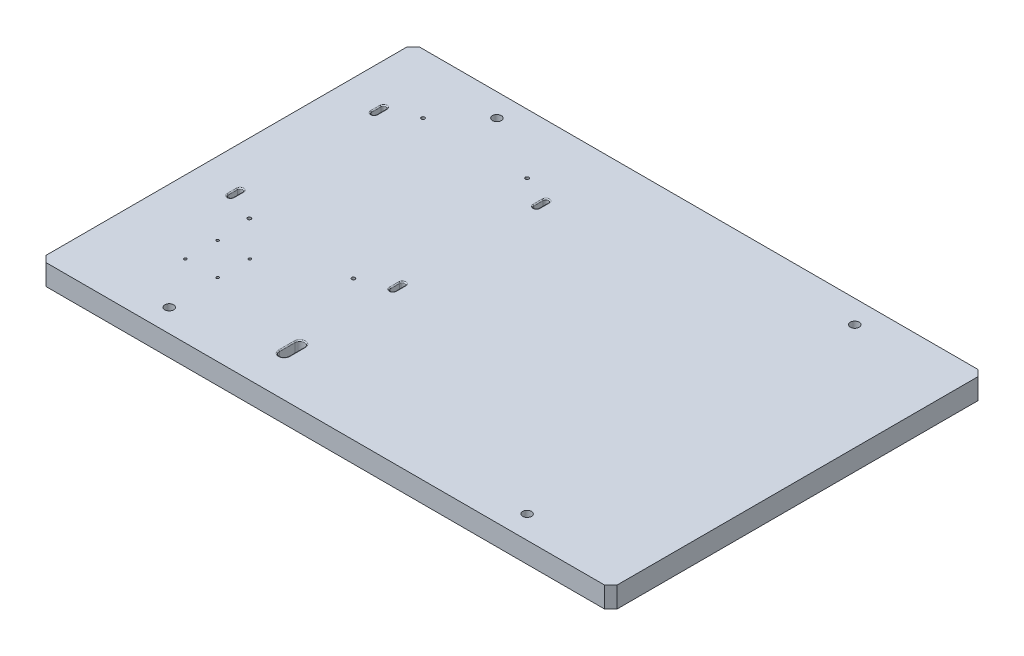
from build123d import *

# Parameters (mm, degrees)
SKETCH_1_W               = 549
SKETCH_1_H               = 359
EXTRUDE_1_DEPTH          = 20
HOLE_WIZARD_M10_1_D      = 8.5
HOLE_WIZARD_M4_1_D       = 3.3
CUT_EXTRUDE_1_DEPTH      = 588.021377852
CUT_EXTRUDE_1_DEPTH_BACK = 588.021377852
CHAMFER_1_SIZE           = 6
FILLET_2_R               = 1
CUT_EXTRUDE_4_DEPTH      = 20
HOLE_WIZARD_M3_2_D       = 2.5
FILLET_4_R               = 1
SKETCH_20_R              = 8.1
CUT_EXTRUDE_5_DEPTH      = 10


with BuildPart() as part:
    # 草图1 → 凸台-拉伸1 (new body)
    with BuildSketch(Plane(origin=(0, 0, 0), x_dir=(1, 0, 0), z_dir=(0, 1, 0))):
        with Locations((214.498740765, -144.65170767)):
            Rectangle(SKETCH_1_W, SKETCH_1_H)
    extrude(amount=EXTRUDE_1_DEPTH)

    # M10 螺纹孔1 (through all)
    with Locations(Plane(origin=(0, 20, 0), x_dir=(1, 0, 0), z_dir=(0, 1, 0))):
        with Locations((386.498740765, -302.15170767), (42.498740765, 12.84829233), (386.498740765, 12.84829233), (42.498740765, -302.15170767)):
            Hole(HOLE_WIZARD_M10_1_D / 2)

    # M4 螺纹孔1 (through all)
    with Locations(Plane(origin=(0, 20, 0), x_dir=(1, 0, 0), z_dir=(0, 1, 0))):
        with Locations((6.998740765, -189.65170767), (6.998740765, -22.65170767), (106.998740765, -22.65170767), (106.998740765, -189.65170767)):
            Hole(HOLE_WIZARD_M4_1_D / 2)

    # 草图9 → 切除-拉伸1 (cut, two sides: drawn at the far end of the back side and taken through both)
    with BuildSketch(Plane(origin=(0, 20, 0), x_dir=(1, 0, 0), z_dir=(0, 1, 0)).offset(-CUT_EXTRUDE_1_DEPTH_BACK)):
        with BuildLine():
            Line((-18.501259235, -32.65170767), (-18.501259235, -41.65170767))
            ThreePointArc((-18.501259235, -41.65170767), (-21.001259235, -44.15170767), (-23.501259235, -41.65170767))
            Line((-23.501259235, -41.65170767), (-23.501259235, -32.65170767))
            ThreePointArc((-23.501259235, -32.65170767), (-21.001259235, -30.15170767), (-18.501259235, -32.65170767))
        make_face()
        with BuildLine():
            Line((132.498740765, -32.65170767), (132.498740765, -41.65170767))
            ThreePointArc((132.498740765, -41.65170767), (134.998740765, -44.15170767), (137.498740765, -41.65170767))
            Line((137.498740765, -41.65170767), (137.498740765, -32.65170767))
            ThreePointArc((137.498740765, -32.65170767), (134.998740765, -30.15170767), (132.498740765, -32.65170767))
        make_face()
        with BuildLine():
            Line((132.498740765, -179.65170767), (132.498740765, -170.65170767))
            ThreePointArc((132.498740765, -170.65170767), (134.998740765, -168.15170767), (137.498740765, -170.65170767))
            Line((137.498740765, -170.65170767), (137.498740765, -179.65170767))
            ThreePointArc((137.498740765, -179.65170767), (134.998740765, -182.15170767), (132.498740765, -179.65170767))
        make_face()
        with BuildLine():
            Line((-18.501259235, -179.65170767), (-18.501259235, -170.65170767))
            ThreePointArc((-18.501259235, -170.65170767), (-21.001259235, -168.15170767), (-23.501259235, -170.65170767))
            Line((-23.501259235, -170.65170767), (-23.501259235, -179.65170767))
            ThreePointArc((-23.501259235, -179.65170767), (-21.001259235, -182.15170767), (-18.501259235, -179.65170767))
        make_face()
    extrude(amount=CUT_EXTRUDE_1_DEPTH + CUT_EXTRUDE_1_DEPTH_BACK, mode=Mode.SUBTRACT)

    # 倒角1
    chamfer_1_edges = [part.edges().sort_by_distance(p)[0] for p in [
        (-60.001259235, 10, -34.84829233),
        (488.998740765, 10, -34.84829233),
        (488.998740765, 10, 324.15170767),
        (-60.001259235, 10, 324.15170767),
    ]]
    chamfer(chamfer_1_edges, length=CHAMFER_1_SIZE)

    # 圆角2
    fillet_2_edges = [part.edges().sort_by_distance(p)[0] for p in [
        (134.998740765, 20, 44.15170767),
        (137.498740765, 20, 37.15170767),
        (-21.001259235, 0, 30.15170767),
        (-18.501259235, 0, 37.15170767),
        (-21.001259235, 0, 44.15170767),
        (-23.501259235, 0, 37.15170767),
        (-21.001259235, 20, 30.15170767),
        (-23.501259235, 20, 37.15170767),
        (-21.001259235, 20, 44.15170767),
        (-18.501259235, 20, 37.15170767),
        (-21.001259235, 0, 182.15170767),
        (-23.501259235, 0, 175.15170767),
        (-21.001259235, 0, 168.15170767),
        (-18.501259235, 0, 175.15170767),
        (-21.001259235, 20, 182.15170767),
        (-18.501259235, 20, 175.15170767),
        (-21.001259235, 20, 168.15170767),
        (-23.501259235, 20, 175.15170767),
        (134.998740765, 0, 182.15170767),
        (132.498740765, 0, 175.15170767),
        (134.998740765, 0, 168.15170767),
        (137.498740765, 0, 175.15170767),
        (134.998740765, 20, 182.15170767),
        (137.498740765, 20, 175.15170767),
        (134.998740765, 20, 168.15170767),
        (132.498740765, 20, 175.15170767),
        (134.998740765, 0, 30.15170767),
        (137.498740765, 0, 37.15170767),
        (134.998740765, 0, 44.15170767),
        (132.498740765, 0, 37.15170767),
        (134.998740765, 20, 30.15170767),
        (132.498740765, 20, 37.15170767),
    ]]
    fillet(fillet_2_edges, radius=FILLET_2_R)

    # 草图16 → 切除-拉伸4 (cut)
    with BuildSketch(Plane.XZ):
        with BuildLine():
            Line((131.498740765, 270.182944489), (131.498740765, 285.182944489))
            ThreePointArc((131.498740765, 285.182944489), (135.998740765, 289.682944489), (140.498740765, 285.182944489))
            Line((140.498740765, 285.182944489), (140.498740765, 270.182944489))
            ThreePointArc((140.498740765, 270.182944489), (135.998740765, 265.682944489), (131.498740765, 270.182944489))
        make_face()
    extrude(amount=-CUT_EXTRUDE_4_DEPTH, mode=Mode.SUBTRACT)

    # M3 螺纹孔2 (through all)
    with Locations(Plane.XZ):
        with Locations((9.998740765, 254.15170767), (40.998740765, 254.15170767), (9.998740765, 223.15170767), (40.998740765, 223.15170767)):
            Hole(HOLE_WIZARD_M3_2_D / 2)

    # 圆角4
    fillet_4_edges = [part.edges().sort_by_distance(p)[0] for p in [
        (135.998740765, 0, 265.682944489),
        (140.498740765, 0, 277.682944489),
        (135.998740765, 0, 289.682944489),
        (131.498740765, 0, 277.682944489),
        (140.498740765, 20, 277.682944489),
        (135.998740765, 20, 289.682944489),
        (131.498740765, 20, 277.682944489),
        (135.998740765, 20, 265.682944489),
    ]]
    fillet(fillet_4_edges, radius=FILLET_4_R)

    # 草图20 → 切除-拉伸5 (cut)
    with BuildSketch(Plane.XZ):
        with Locations(Location((42.498740765, 302.15170767, 0), (0, 0, 270))):
            Circle(SKETCH_20_R)
        with Locations(Location((386.498740765, 302.15170767, 0), (0, 0, 270))):
            Circle(SKETCH_20_R)
        with Locations(Location((386.498740765, -12.84829233, 0), (0, 0, 270))):
            Circle(SKETCH_20_R)
        with Locations(Location((42.498740765, -12.84829233, 0), (0, 0, 270))):
            Circle(SKETCH_20_R)
    extrude(amount=-CUT_EXTRUDE_5_DEPTH, mode=Mode.SUBTRACT)


solid = part.part
